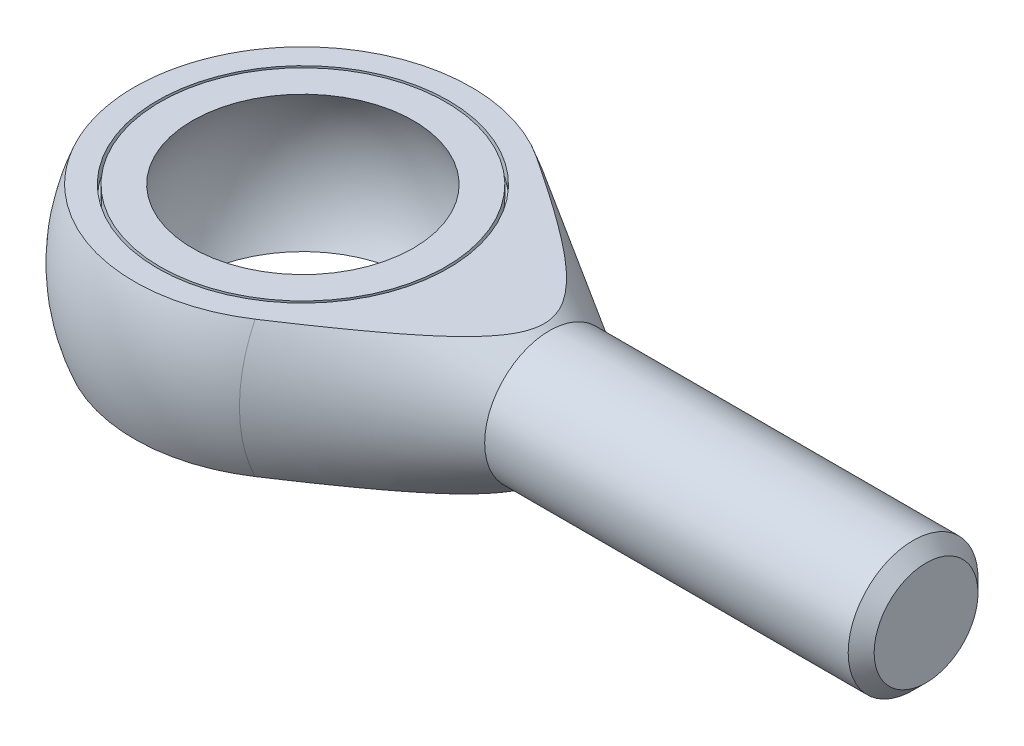
from build123d import *

# Parameters (mm, degrees)
CUT_EXTRUDE1_DEPTH      = 28.440845468
CUT_EXTRUDE1_DEPTH_BACK = 28.440845468
SKETCH3_W               = 33
SKETCH3_H               = 8.75
SKETCH4_W               = 0.2
SKETCH4_H               = 1
SKETCH5_R               = 5
BOSS_EXTRUDE1_DEPTH     = 29
CHAMFER1_SIZE           = 1


with BuildPart() as part:
    # Sketch2 → Revolve2 (revolve)
    with BuildSketch(Plane(origin=(0, 0, 0), x_dir=(1, 0, 0), z_dir=(0, 1, 0))):
        with BuildLine():
            Line((7.147970434, 12.037712352), (19, 5))
            Line((19, 5), (19, 0))
            Line((19, 0), (-14, 0))
            ThreePointArc((-14, 0), (-6.925619609, 12.166996056), (7.147970434, 12.037712352))
        make_face()
    revolve(axis=Axis((-39.456415939, 0, 0), (1, 0, 0)))

    # Sketch3 → Cut-Extrude1 (cut, two sides: drawn at the far end of the back side and taken through both)
    with BuildSketch(Plane.XY.offset(-CUT_EXTRUDE1_DEPTH_BACK)):
        with Locations((2.5, 9.625)):
            Rectangle(SKETCH3_W, SKETCH3_H)
        with Locations((2.5, -9.625)):
            Rectangle(SKETCH3_W, SKETCH3_H)
    extrude(amount=CUT_EXTRUDE1_DEPTH + CUT_EXTRUDE1_DEPTH_BACK, mode=Mode.SUBTRACT)

    # Sketch4 → Cut-Revolve1 (revolve, cut)
    with BuildSketch(Plane.XY, mode=Mode.PRIVATE) as cut_revolve1_sk:
        with BuildLine():
            Line((0, 10), (0, -10))
            ThreePointArc((0, -10), (10, 0), (0, 10))
        make_face()
        with Locations((11.1, 4.75)):
            Rectangle(SKETCH4_W, SKETCH4_H)
        with Locations((11.1, -4.75)):
            Rectangle(SKETCH4_W, SKETCH4_H)
    revolve(cut_revolve1_sk.sketch.rotate(Axis((0, 13.975998128, 0), (0, -1, 0)), 90), axis=Axis((0, 13.975998128, 0), (0, -1, 0)), mode=Mode.SUBTRACT)

    # Sketch5 → Boss-Extrude1 (add)
    with BuildSketch(Plane(origin=(19, 0, 0), x_dir=(0, 0, -1), z_dir=(1, 0, 0))):
        with Locations(Location((0, 0, 0), (0, 0, 180))):
            Circle(SKETCH5_R)
    extrude(amount=BOSS_EXTRUDE1_DEPTH)

    # Chamfer1
    chamfer1_edges = [part.edges().sort_by_distance(p)[0] for p in [
        (48, 0, -5),
    ]]
    chamfer(chamfer1_edges, length=CHAMFER1_SIZE)


solid = part.part
